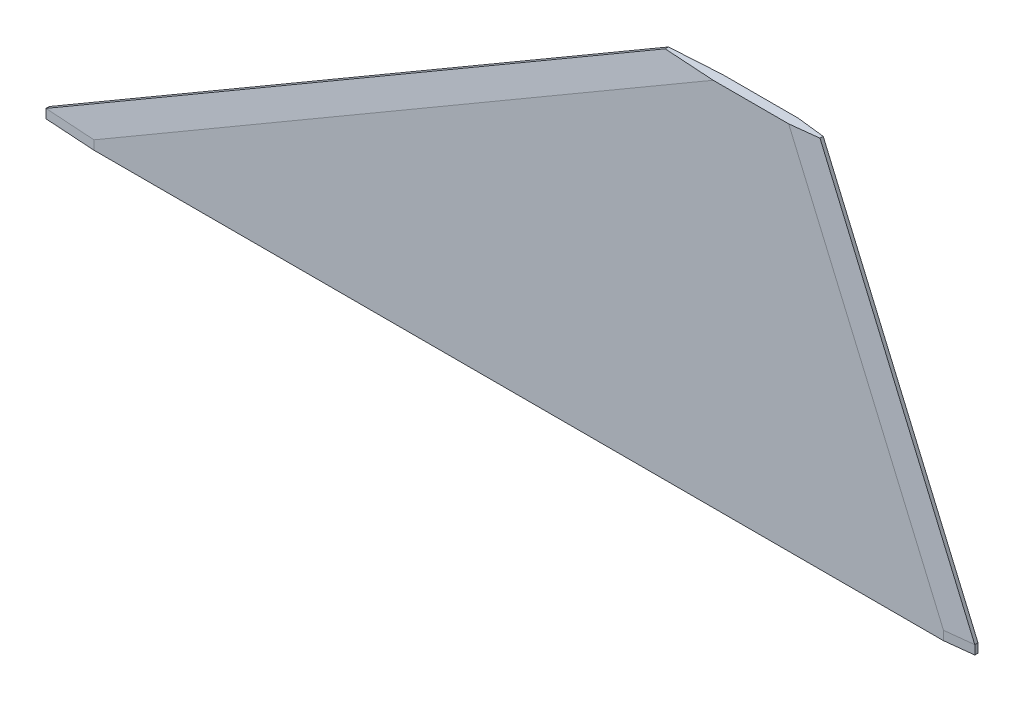
from build123d import *

# Parameters (mm, degrees)
BOSS_EXTRUDE1_DEPTH = 4.7625
CHAMFER1_SIZE       = 1.5875
CHAMFER1_SIZE2      = 12.7
CHAMFER2_SIZE       = 1.5875
CHAMFER2_SIZE2      = 12.7
BOSS_EXTRUDE2_DEPTH = 4.445


with BuildPart() as part:
    # Sketch1 → Boss-Extrude1 (new body)
    with BuildSketch(Plane.XY):
        Polygon((0, 0), (457.2, 0), (381, 177.8), (304.8, 177.8), align=None)
    extrude(amount=BOSS_EXTRUDE1_DEPTH)

    # Chamfer1
    chamfer1_edges = [part.edges().sort_by_distance(p)[0] for p in [
        (152.4, 88.9, 4.7625),
        (152.4, 88.9, 0),
    ]]
    chamfer1_side = [part.faces().sort_by_distance(p)[0] for p in [
        (152.4, 88.9, 2.38125),
    ]]
    chamfer(chamfer1_edges, length=CHAMFER1_SIZE, length2=CHAMFER1_SIZE2, reference=chamfer1_side[0])

    # Chamfer2
    chamfer2_edges = [part.edges().sort_by_distance(p)[0] for p in [
        (419.1, 88.9, 4.7625),
        (419.1, 88.9, 0),
    ]]
    chamfer2_side = [part.faces().sort_by_distance(p)[0] for p in [
        (419.1, 88.9, 2.38125),
    ]]
    chamfer(chamfer2_edges, length=CHAMFER2_SIZE, length2=CHAMFER2_SIZE2, reference=chamfer2_side[0])

    # Sketch2 → Boss-Extrude2 (add)
    with BuildSketch(Plane.XZ):
        Polygon((25.204862667, 0), (443.382811651, 0), (457.2, 1.5875), (457.2, 3.175), (443.382811651, 4.7625), (25.204862667, 4.7625), (0, 3.175), (0, 1.5875), align=None)
    extrude(amount=BOSS_EXTRUDE2_DEPTH)


solid = part.part
